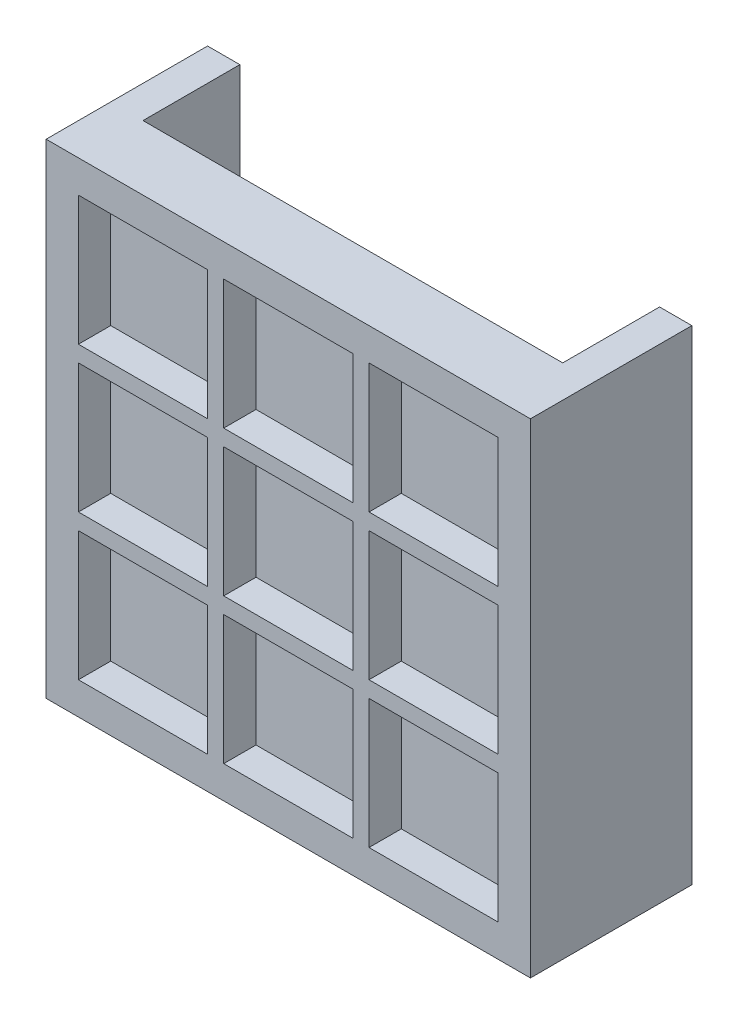
from build123d import *

# Parameters (mm, degrees)
SKETCH1_W           = 150
SKETCH1_H           = 150
BOSS_EXTRUDE1_DEPTH = 10
SKETCH2_W           = 40
SKETCH2_H           = 5
SKETCH2_H_2         = 10
BOSS_EXTRUDE2_DEPTH = 10
SKETCH3_W           = 40
SKETCH3_H           = 5
CUT_EXTRUDE1_DEPTH  = 10
SKETCH4_W           = 10
SKETCH4_H           = 150
BOSS_EXTRUDE3_DEPTH = 30


with BuildPart() as part:
    # Sketch1 → Boss-Extrude1 (new body)
    with BuildSketch(Plane.XY):
        with Locations((-31.208053691, -10.570469799)):
            Rectangle(SKETCH1_W, SKETCH1_H)
    extrude(amount=BOSS_EXTRUDE1_DEPTH)

    # Sketch2 → Boss-Extrude2 (add)
    with BuildSketch(Plane.XY.offset(10)):
        Polygon((-96.208053691, 64.429530201), (-106.208053691, 64.429530201), (-106.208053691, -85.570469799), (-96.208053691, -85.570469799), (-96.208053691, -75.570469799), (-96.208053691, -35.570469799), (-96.208053691, -30.570469799), (-96.208053691, 9.429530201), (-96.208053691, 14.429530201), (-96.208053691, 54.429530201), align=None)
        with Locations((-76.208053691, 11.929530201)):
            Rectangle(SKETCH2_W, SKETCH2_H)
        Polygon((-51.208053691, 64.429530201), (-56.208053691, 64.429530201), (-56.208053691, 54.429530201), (-56.208053691, 14.429530201), (-56.208053691, 9.429530201), (-56.208053691, -30.570469799), (-56.208053691, -35.570469799), (-56.208053691, -75.570469799), (-56.208053691, -85.570469799), (-51.208053691, -85.570469799), (-51.208053691, -75.570469799), (-51.208053691, -35.570469799), (-51.208053691, -30.570469799), (-51.208053691, 9.429530201), (-51.208053691, 14.429530201), (-51.208053691, 54.429530201), align=None)
        with Locations((-76.208053691, 59.429530201)):
            Rectangle(SKETCH2_W, SKETCH2_H_2)
        with Locations((-31.208053691, 59.429530201)):
            Rectangle(SKETCH2_W, SKETCH2_H_2)
        Polygon((-6.208053691, 64.429530201), (-11.208053691, 64.429530201), (-11.208053691, 54.429530201), (-11.208053691, 14.429530201), (-11.208053691, 9.429530201), (-11.208053691, -30.570469799), (-11.208053691, -35.570469799), (-11.208053691, -75.570469799), (-11.208053691, -85.570469799), (-6.208053691, -85.570469799), (-6.208053691, -75.570469799), (-6.208053691, -35.570469799), (-6.208053691, -30.570469799), (-6.208053691, 9.429530201), (-6.208053691, 14.429530201), (-6.208053691, 54.429530201), align=None)
        with Locations((13.791946309, 59.429530201)):
            Rectangle(SKETCH2_W, SKETCH2_H_2)
        Polygon((43.791946309, 64.429530201), (33.791946309, 64.429530201), (33.791946309, 54.429530201), (33.791946309, 14.429530201), (33.791946309, 9.429530201), (33.791946309, -30.570469799), (33.791946309, -35.570469799), (33.791946309, -75.570469799), (33.791946309, -85.570469799), (43.791946309, -85.570469799), align=None)
        with Locations((-76.208053691, -80.570469799)):
            Rectangle(SKETCH2_W, SKETCH2_H_2)
        with Locations((13.791946309, -80.570469799)):
            Rectangle(SKETCH2_W, SKETCH2_H_2)
        with Locations((-31.208053691, -80.570469799)):
            Rectangle(SKETCH2_W, SKETCH2_H_2)
        with Locations((-31.208053691, 11.929530201)):
            Rectangle(SKETCH2_W, SKETCH2_H)
        with Locations((13.791946309, 11.929530201)):
            Rectangle(SKETCH2_W, SKETCH2_H)
        with Locations((13.791946309, -33.070469799)):
            Rectangle(SKETCH2_W, SKETCH2_H)
        with Locations((-76.208053691, -33.070469799)):
            Rectangle(SKETCH2_W, SKETCH2_H)
        with Locations((-31.208053691, -33.070469799)):
            Rectangle(SKETCH2_W, SKETCH2_H)
    extrude(amount=BOSS_EXTRUDE2_DEPTH)

    # Sketch3 → Cut-Extrude1 (cut)
    with BuildSketch(Plane.XY.offset(10)):
        with Locations((-76.208053691, 51.929530201)):
            Rectangle(SKETCH3_W, SKETCH3_H)
        with Locations((-31.208053691, 51.929530201)):
            Rectangle(SKETCH3_W, SKETCH3_H)
        with Locations((13.791946309, 51.929530201)):
            Rectangle(SKETCH3_W, SKETCH3_H)
        with Locations((-76.208053691, 6.929530201)):
            Rectangle(SKETCH3_W, SKETCH3_H)
        with Locations((-31.208053691, 6.929530201)):
            Rectangle(SKETCH3_W, SKETCH3_H)
        with Locations((13.791946309, 6.929530201)):
            Rectangle(SKETCH3_W, SKETCH3_H)
        with Locations((-76.208053691, -38.070469799)):
            Rectangle(SKETCH3_W, SKETCH3_H)
        with Locations((-31.208053691, -38.070469799)):
            Rectangle(SKETCH3_W, SKETCH3_H)
        with Locations((13.791946309, -38.070469799)):
            Rectangle(SKETCH3_W, SKETCH3_H)
    extrude(amount=-CUT_EXTRUDE1_DEPTH, mode=Mode.SUBTRACT)

    # Sketch4 → Boss-Extrude3 (add)
    with BuildSketch(Plane(origin=(0, 0, 0), x_dir=(-1, 0, 0), z_dir=(0, 0, -1))):
        with Locations((-38.791946309, -10.570469799)):
            Rectangle(SKETCH4_W, SKETCH4_H)
        with Locations((101.208053691, -10.570469799)):
            Rectangle(SKETCH4_W, SKETCH4_H)
    extrude(amount=BOSS_EXTRUDE3_DEPTH)


solid = part.part
